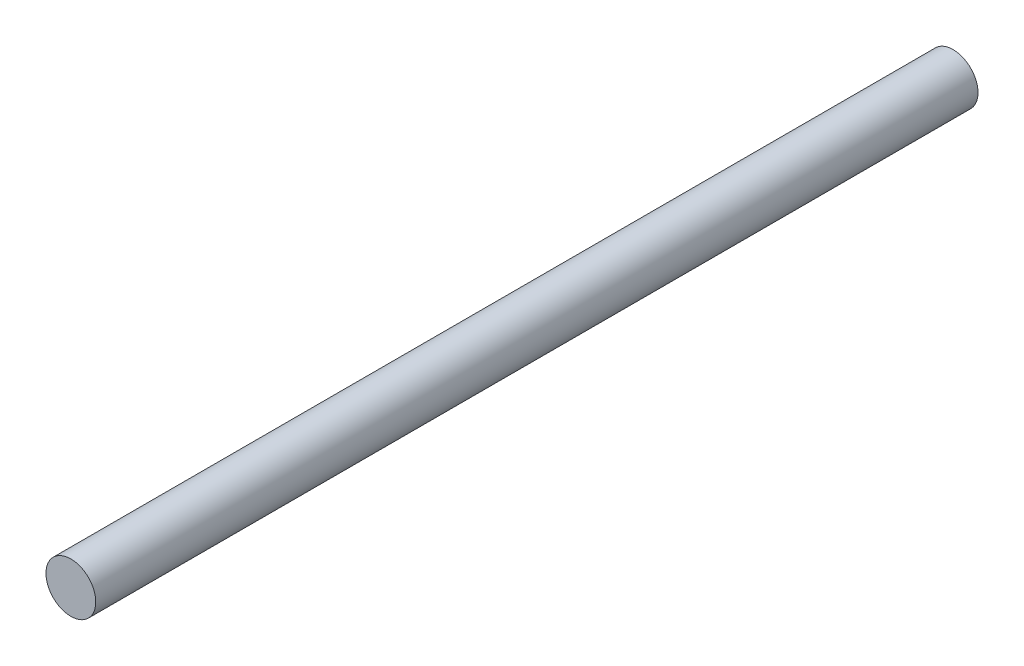
from build123d import *

# Parameters (mm, degrees)
ESBO_O1_R                = 1.75
RESSALTO_EXTRUS_O1_DEPTH = 62


with BuildPart() as part:
    # Esboço1 → Ressalto-extrusão1 (new body)
    with BuildSketch(Plane.XY):
        Circle(ESBO_O1_R)
    extrude(amount=RESSALTO_EXTRUS_O1_DEPTH)


solid = part.part
